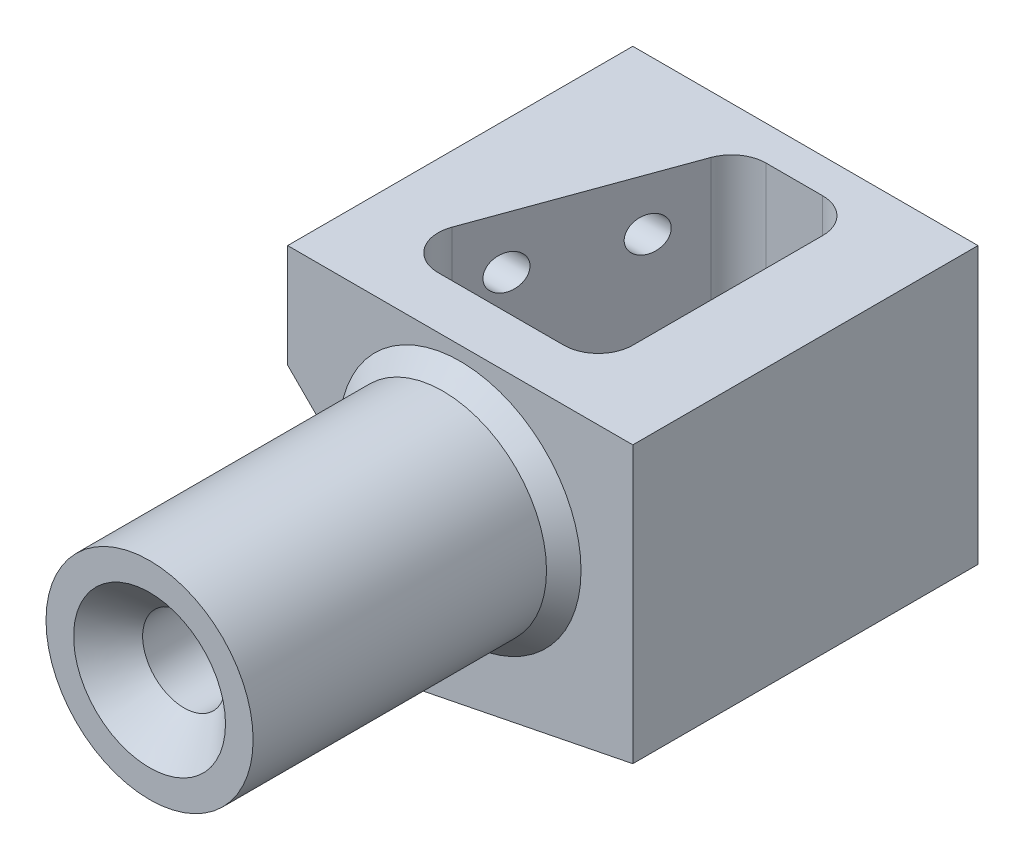
from build123d import *

# Parameters (mm, degrees)
SKETCH1_R                                       = 3
BOSS_EXTRUDE1_DEPTH                             = 10
SKETCH1_3_R                                     = 3
BOSS_EXTRUDE2_DEPTH                             = 9
CUT_EXTRUDE1_DEPTH                              = 10
SKETCH2_R                                       = 0.5
CUT_EXTRUDE2_DEPTH                              = 5
CHAMFER1_SIZE                                   = 0.5
CSK_FOR_M2_FLAT_HEAD_MACHINE_SCREW1_D           = 2.4
CSK_FOR_M2_FLAT_HEAD_MACHINE_SCREW1_DEPTH       = 10.5
CSK_FOR_M2_FLAT_HEAD_MACHINE_SCREW1_CSINK_D     = 4.4
CSK_FOR_M2_FLAT_HEAD_MACHINE_SCREW1_CSINK_ANGLE = 90


with BuildPart() as part:
    # Sketch1 → Boss-Extrude1 (new body)
    # profile 1 of 3: a face of its own
    with BuildSketch(Plane.XY):
        Polygon((-4, 1), (-4, -4.8), (5, -3), (5, 5), (-4, 5), align=None)
        with Locations((0, 1.099019514)):
            Circle(SKETCH1_R, mode=Mode.SUBTRACT)
    # profile 2 of 3: a face of its own
    with BuildSketch(Plane.XY):
        Polygon((-5, 2), (-4, 1), (-4, 5), (-5, 5), align=None)
    # profile 3 of 3: a face of its own
    with BuildSketch(Plane.XY):
        with Locations((0, 1.099019514)):
            Circle(SKETCH1_R)
    extrude(amount=-BOSS_EXTRUDE1_DEPTH)

    # Sketch1<3> → Boss-Extrude2 (add)
    with BuildSketch(Plane.XY):
        with Locations((0, 1.099019514)):
            Circle(SKETCH1_3_R)
    extrude(amount=BOSS_EXTRUDE2_DEPTH)

    # Sketch5 → Cut-Extrude1 (cut)
    with BuildSketch(Plane(origin=(0, 5, 0), x_dir=(1, 0, 0), z_dir=(0, 1, 0))):
        with BuildLine():
            Line((1.5, 9), (-0.140385722, 9))
            ThreePointArc((-0.140385722, 9), (-0.713962158, 8.819152044), (-1.080078342, 8.342020143))
            Line((-1.080078342, 8.342020143), (-3.081914631, 2.842020143))
            ThreePointArc((-3.081914631, 2.842020143), (-2.961374054, 1.926423564), (-2.14222201, 1.5))
            Line((-2.14222201, 1.5), (0, 1.5))
            Line((0, 1.5), (1.5, 1.5))
            ThreePointArc((1.5, 1.5), (2.207106781, 1.792893219), (2.5, 2.5))
            Line((2.5, 2.5), (2.5, 4))
            Line((2.5, 4), (2.5, 8))
            ThreePointArc((2.5, 8), (2.207106781, 8.707106781), (1.5, 9))
        make_face()
    extrude(amount=-CUT_EXTRUDE1_DEPTH, mode=Mode.SUBTRACT)

    # Sketch2 → Cut-Extrude2 (cut)
    with BuildSketch(Plane.ZY.offset(5)):
        with Locations(Location((-7, 3.5, 0), (0, 0, 270))):
            Circle(SKETCH2_R)
        with Locations(Location((-4, 3.5, 0), (0, 0, 270))):
            Circle(SKETCH2_R)
    extrude(amount=-CUT_EXTRUDE2_DEPTH, mode=Mode.SUBTRACT)

    # Chamfer1
    chamfer1_edges = [part.edges().sort_by_distance(p)[0] for p in [
        (-3, 1.099019514, 0),
    ]]
    chamfer(chamfer1_edges, length=CHAMFER1_SIZE)

    # CSK for M2 Flat Head Machine Screw1
    with Locations(Plane.XY.offset(9)):
        with Locations((0, 1.099019514)):
            CounterSinkHole(CSK_FOR_M2_FLAT_HEAD_MACHINE_SCREW1_D / 2, CSK_FOR_M2_FLAT_HEAD_MACHINE_SCREW1_CSINK_D / 2, depth=CSK_FOR_M2_FLAT_HEAD_MACHINE_SCREW1_DEPTH, counter_sink_angle=CSK_FOR_M2_FLAT_HEAD_MACHINE_SCREW1_CSINK_ANGLE)


solid = part.part
